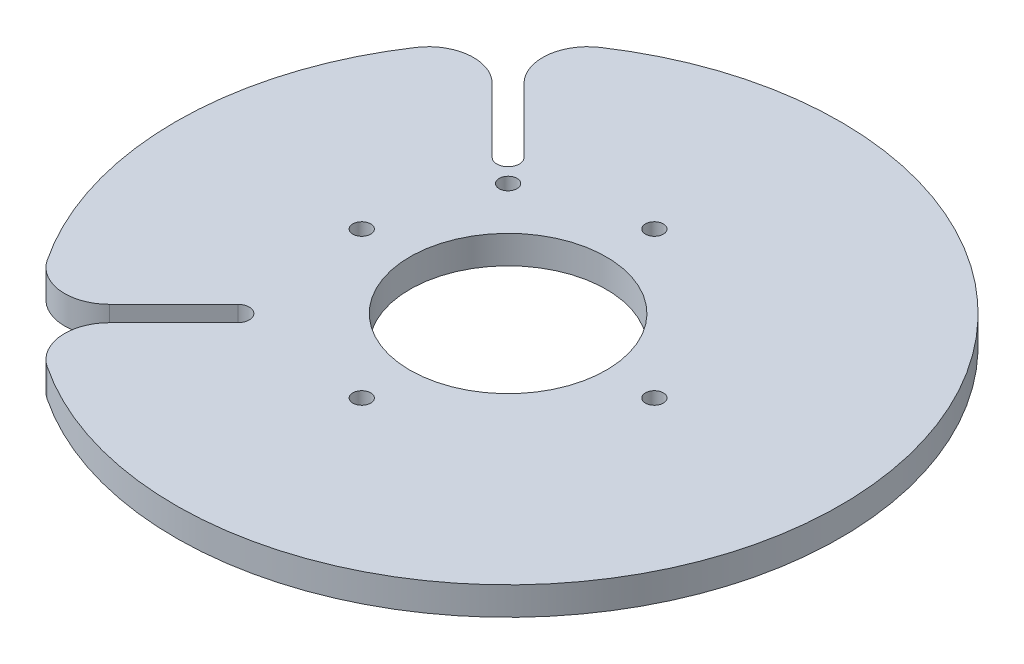
from build123d import *

# Parameters (mm, degrees)
SKETCH1_R           = 75
BOSS_EXTRUDE1_DEPTH = 6.35
SKETCH45_R          = 22.1615
SKETCH45_R_2        = 2.0193
CUT_EXTRUDE36_DEPTH = 107.255929246
FILLET2_R           = 10.16


with BuildPart() as part:
    # Sketch1 → Boss-Extrude1 (new body)
    with BuildSketch(Plane(origin=(0, 0, 0), x_dir=(1, 0, 0), z_dir=(0, 1, 0))):
        with Locations(Location((0, 0, 0), (0, 0, 270))):
            Circle(SKETCH1_R)
    extrude(amount=BOSS_EXTRUDE1_DEPTH)

    # Sketch45 → Cut-Extrude36 (cut, through all)
    with BuildSketch(Plane(origin=(0, 6.35, 0), x_dir=(1, 0, 0), z_dir=(0, 1, 0))):
        with Locations(Location((0, 0, 0), (0, 0, 270))):
            Circle(SKETCH45_R)
        with Locations(Location((0, 33.02, 0), (0, 0, 270))):
            Circle(SKETCH45_R_2)
        with Locations(Location((-33.02, 0, 0), (0, 0, 270))):
            Circle(SKETCH45_R_2)
        with Locations(Location((0, -33.02, 0), (0, 0, 270))):
            Circle(SKETCH45_R_2)
        with Locations(Location((33.02, 0, 0), (0, 0, 270))):
            Circle(SKETCH45_R_2)
        with Locations(Location((-25.4, 25.4, 0), (0, 0, 270))):
            Circle(SKETCH45_R_2)
        with BuildLine():
            Line((-32.276051224, 28.683948776), (-54.798637954, 51.206535505))
            ThreePointArc((-54.798637954, 51.206535505), (-54.798637954, 54.798637954), (-51.206535505, 54.798637954))
            Line((-51.206535505, 54.798637954), (-28.683948776, 32.276051224))
            ThreePointArc((-28.683948776, 32.276051224), (-28.683948776, 28.683948776), (-32.276051224, 28.683948776))
        make_face()
        with BuildLine():
            Line((-28.683948776, -32.276051224), (-51.206535505, -54.798637954))
            ThreePointArc((-51.206535505, -54.798637954), (-54.798637954, -54.798637954), (-54.798637954, -51.206535505))
            Line((-54.798637954, -51.206535505), (-32.276051224, -28.683948776))
            ThreePointArc((-32.276051224, -28.683948776), (-28.683948776, -28.683948776), (-28.683948776, -32.276051224))
        make_face()
    extrude(amount=-CUT_EXTRUDE36_DEPTH, mode=Mode.SUBTRACT)

    # Fillet2
    fillet2_edges = [part.edges().sort_by_distance(p)[0] for p in [
        (-51.206535505, 3.175, 54.798637954),
        (-54.798637954, 3.175, 51.206535505),
        (-54.798637954, 3.175, -51.206535505),
        (-51.206535505, 3.175, -54.798637954),
    ]]
    fillet(fillet2_edges, radius=FILLET2_R)


solid = part.part
